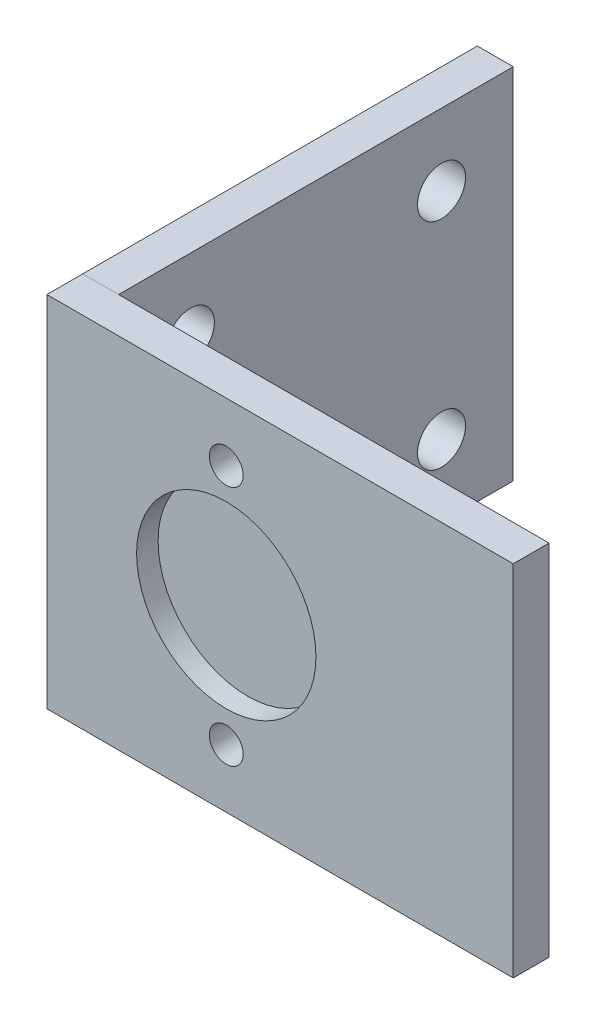
from build123d import *

# Parameters (mm, degrees)
SKETCH1_W                           = 27.94
SKETCH1_H                           = 25.4
SIDE_CONNECTING_TO_GRIP_DEPTH       = 2.54
M3_CLEARANCE_HOLE1_D                = 3.4
SIDE_CONNECTING_TO_SERVO_DEPTH      = 30.48
SIDE_CONNECTING_TO_SERVO_DEPTH_BACK = 2.54
SKETCH6_W                           = 2.54
SKETCH6_H                           = 25.4
SKETCH9_W                           = 1.2
SKETCH9_H                           = 30.48
CUTOUT_SERVO_HOLES_AT_2_COUNT       = 2
CUTOUT_SERVO_HOLES_AT_2_PITCH       = 17.1
SKETCH10_R                          = 6.35
CUT_EXTRUDE1_DEPTH                  = 1.524


with BuildPart() as part:
    # Sketch1 → side connecting to grip (new body)
    with BuildSketch(Plane(origin=(0, 0, 0), x_dir=(0, 0, -1), z_dir=(1, 0, 0))):
        with Locations((-31.87684378, 4.036305379)):
            Rectangle(SKETCH1_W, SKETCH1_H)
    extrude(amount=SIDE_CONNECTING_TO_GRIP_DEPTH)

    # M3 Clearance Hole1 (through all)
    with Locations(Plane(origin=(2.54, 0, 0), x_dir=(0, 0, -1), z_dir=(1, 0, 0))):
        with Locations((-40.76684378, 11.656305379), (-22.98684378, 11.656305379), (-22.98684378, -3.583694621), (-40.76684378, -3.583694621)):
            Hole(M3_CLEARANCE_HOLE1_D / 2)


with BuildPart() as body_2:
    # Sketch6 → side connecting to servo (new, two sides: drawn at the far end of the back side and taken through both)
    with BuildSketch(Plane(origin=(2.54, 0, 0), x_dir=(0, 0, -1), z_dir=(1, 0, 0)).offset(-SIDE_CONNECTING_TO_SERVO_DEPTH_BACK)):
        with Locations((-47.11684378, 4.036305379)):
            Rectangle(SKETCH6_W, SKETCH6_H)
    extrude(amount=SIDE_CONNECTING_TO_SERVO_DEPTH + SIDE_CONNECTING_TO_SERVO_DEPTH_BACK)

    # Sketch9 → cutout servo holes (revolve, cut)
    with BuildSketch(Plane(origin=(12.7, 12.586305379, 48.38684378), x_dir=(0, -1, 0), z_dir=(1, 0, 0))):
        with Locations((0.6, 15.24)):
            Rectangle(SKETCH9_W, SKETCH9_H)
    cutout_servo_holes = revolve(axis=Axis((12.7, 12.586305379, 54.73684378), (0, 0, -1)), mode=Mode.SUBTRACT)

    # cutout servo holes at 2: cutout servo holes ×2
    with Locations(*[(0, -i * CUTOUT_SERVO_HOLES_AT_2_PITCH, 0) for i in range(1, CUTOUT_SERVO_HOLES_AT_2_COUNT)]):
        add(cutout_servo_holes, mode=Mode.SUBTRACT)

    # Sketch10 → Cut-Extrude1 (cut)
    with BuildSketch(Plane.XY.offset(48.38684378)):
        with Locations((12.7, 4.036305379)):
            Circle(SKETCH10_R)
    extrude(amount=-CUT_EXTRUDE1_DEPTH, mode=Mode.SUBTRACT)


solid = Compound([part.part, body_2.part])
